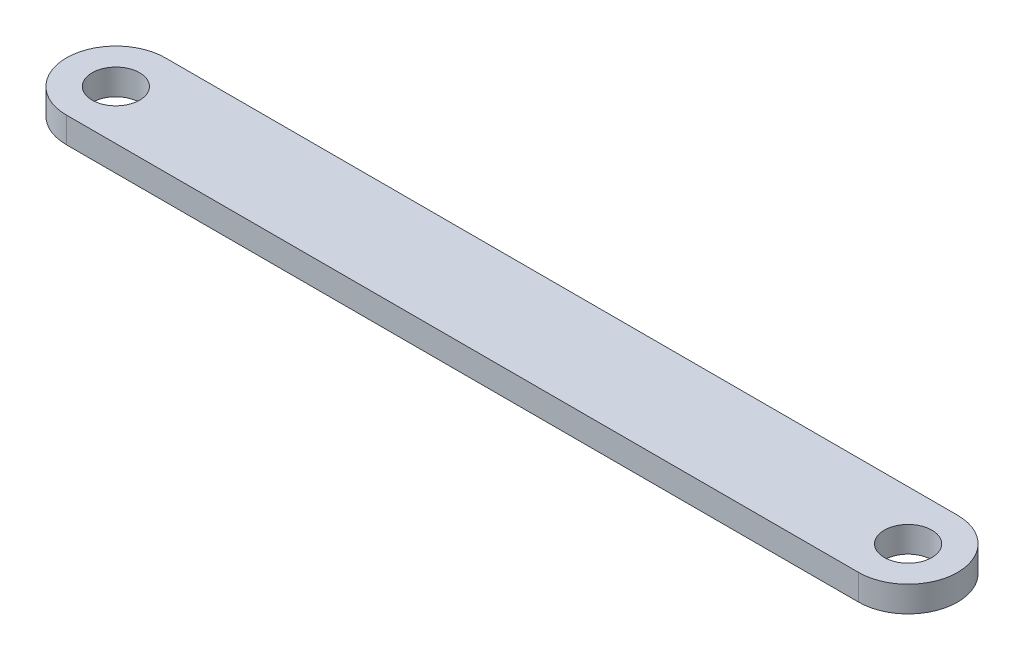
from build123d import *

# Parameters (mm, degrees)
SKETCH1_R           = 6
BOSS_EXTRUDE1_DEPTH = 3.25


with BuildPart() as part:
    # Sketch1 → Boss-Extrude1 (new, symmetric)
    with BuildSketch(Plane(origin=(0, 0, 0), x_dir=(1, 0, 0), z_dir=(0, 1, 0))):
        with BuildLine():
            Line((-100, 12.5), (100, 12.5))
            ThreePointArc((100, 12.5), (112.5, 0), (100, -12.5))
            Line((100, -12.5), (-100, -12.5))
            ThreePointArc((-100, -12.5), (-112.5, 0), (-100, 12.5))
        make_face()
        with Locations(Location((100, 0, 0), (0, 0, 90))):
            Circle(SKETCH1_R, mode=Mode.SUBTRACT)
        with Locations(Location((-100, 0, 0), (0, 0, 90))):
            Circle(SKETCH1_R, mode=Mode.SUBTRACT)
    extrude(amount=BOSS_EXTRUDE1_DEPTH, both=True)


solid = part.part
